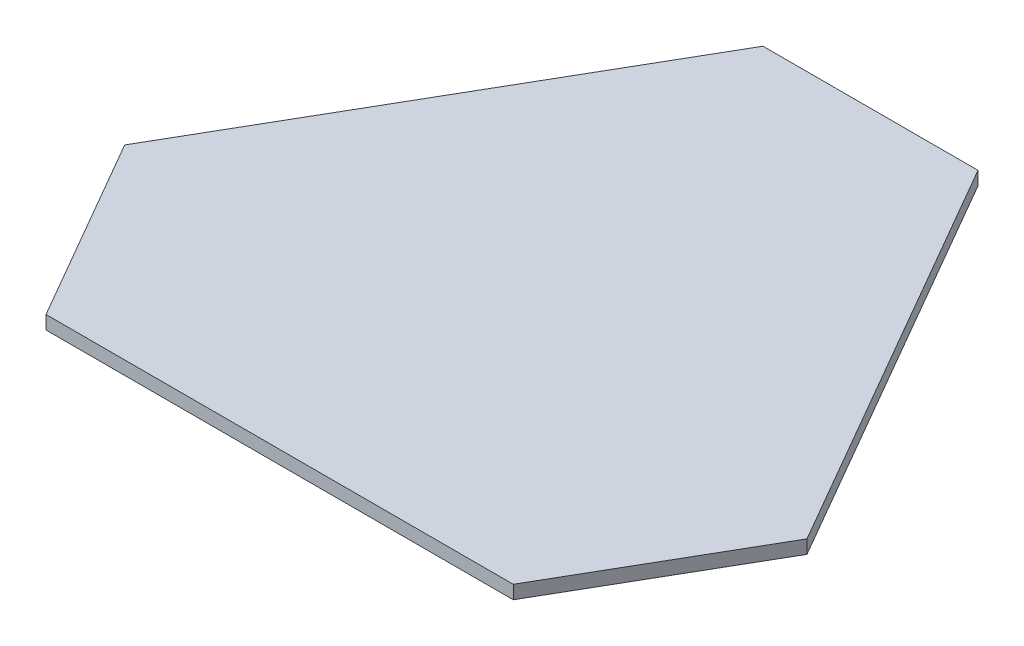
from build123d import *

# Parameters (mm, degrees)
BOSS_EXTRUDE1_DEPTH = 2.5


with BuildPart() as part:
    # Sketch1 → Boss-Extrude1 (new body)
    with BuildSketch(Plane(origin=(0, 0, 0), x_dir=(1, 0, 0), z_dir=(0, 1, 0))):
        Polygon((0.194905289, 62.752177974), (40.194905197, 62.752177974), (83.66237749, -12.535692514), (63.66237749, -47.176708666), (-23.272567004, -47.176708666), (-43.272567004, -12.535692514), align=None)
    extrude(amount=-BOSS_EXTRUDE1_DEPTH)


solid = part.part
